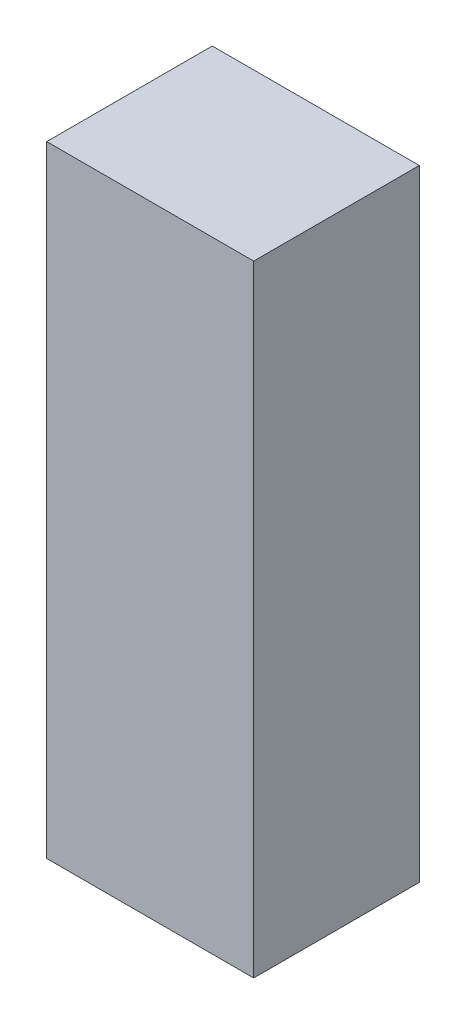
from build123d import *

# Parameters (mm, degrees)
SKETCH1_W           = 10
SKETCH1_H           = 8
BOSS_EXTRUDE1_DEPTH = 30


with BuildPart() as part:
    # Sketch1 → Boss-Extrude1 (new body)
    with BuildSketch(Plane(origin=(0, 0, 0), x_dir=(1, 0, 0), z_dir=(0, 1, 0))):
        Rectangle(SKETCH1_W, SKETCH1_H)
    extrude(amount=BOSS_EXTRUDE1_DEPTH)


solid = part.part
